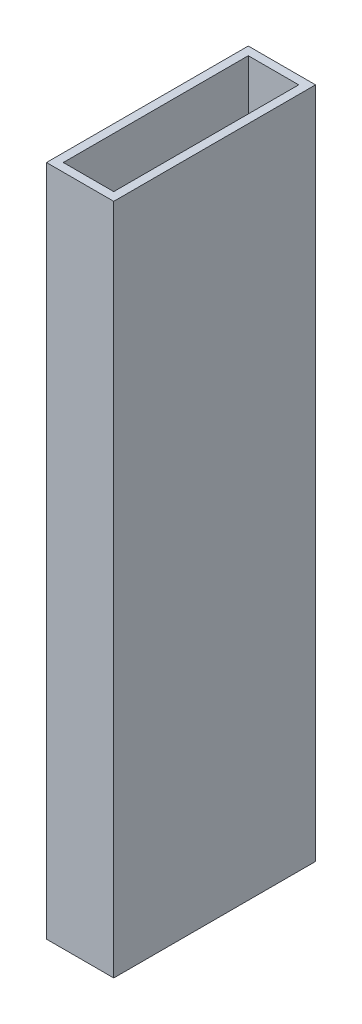
from build123d import *

# Parameters (mm, degrees)
SKETCH1_W           = 3.175
SKETCH1_H           = 69.85
BOSS_EXTRUDE1_DEPTH = 254


with BuildPart() as part:
    # Sketch1 → Boss-Extrude1 (new body)
    with BuildSketch(Plane(origin=(0, 0, 0), x_dir=(1, 0, 0), z_dir=(0, 1, 0))):
        with Locations((1.5875, 38.1)):
            Rectangle(SKETCH1_W, SKETCH1_H)
        Polygon((3.175, 3.175), (0, 3.175), (0, 0), (25.4, 0), (25.4, 3.175), (22.225, 3.175), align=None)
        with Locations((23.8125, 38.1)):
            Rectangle(SKETCH1_W, SKETCH1_H)
        Polygon((25.4, 76.2), (0, 76.2), (0, 73.025), (3.175, 73.025), (22.225, 73.025), (25.4, 73.025), align=None)
    extrude(amount=BOSS_EXTRUDE1_DEPTH)


solid = part.part
